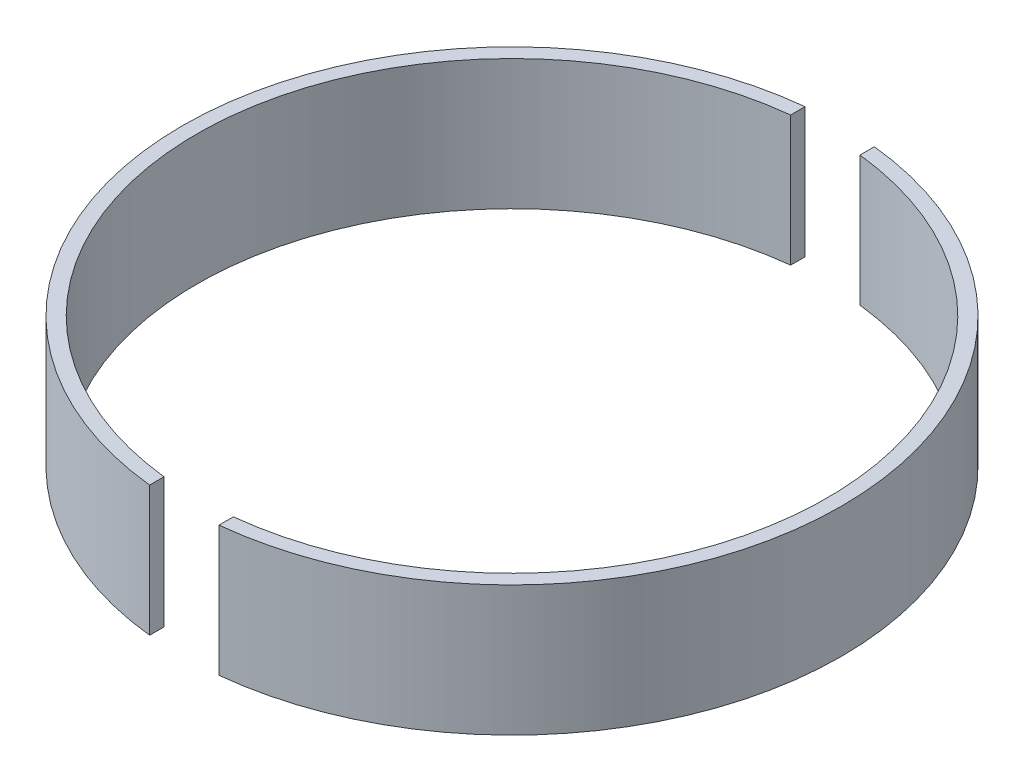
from build123d import *

# Parameters (mm, degrees)
ESQUISSE1_R             = 76
ESQUISSE1_R_2           = 72.7
BOSS_EXTRU_1_DEPTH      = 30
ESQUISSE2_W             = 16
ESQUISSE2_H             = 207.49820715
ENL_V_MAT_EXTRU_1_DEPTH = 112.588529877


with BuildPart() as part:
    # Esquisse1 → Boss.-Extru.1 (new body)
    with BuildSketch(Plane(origin=(0, 0, 0), x_dir=(1, 0, 0), z_dir=(0, 1, 0))):
        with Locations(Location((0, 0, 0), (0, 0, 270))):
            Circle(ESQUISSE1_R)
        with Locations(Location((0, 0, 0), (0, 0, 270))):
            Circle(ESQUISSE1_R_2, mode=Mode.SUBTRACT)
    extrude(amount=BOSS_EXTRU_1_DEPTH)

    # Esquisse2 → Enlèv. mat.-Extru.1 (cut, through all)
    with BuildSketch(Plane.XZ):
        with Locations((0, 22.122568389)):
            Rectangle(ESQUISSE2_W, ESQUISSE2_H)
    extrude(amount=-ENL_V_MAT_EXTRU_1_DEPTH, mode=Mode.SUBTRACT)


with BuildPart() as enl_v_mat_extru_1_piece_1:
    # of the separate pieces the step leaves, piece 1, a body of its own (enl_v_mat_extru_1_pieces)
    add(part.part.solids().sort_by_distance((8, 0, 75.577774511))[0])


with BuildPart() as enl_v_mat_extru_1_piece_2:
    # of the separate pieces the step leaves, piece 2, a body of its own (enl_v_mat_extru_1_pieces)
    add(part.part.solids().sort_by_distance((-8, 0, -75.577774511))[0])


solid = Compound([enl_v_mat_extru_1_piece_1.part, enl_v_mat_extru_1_piece_2.part])
